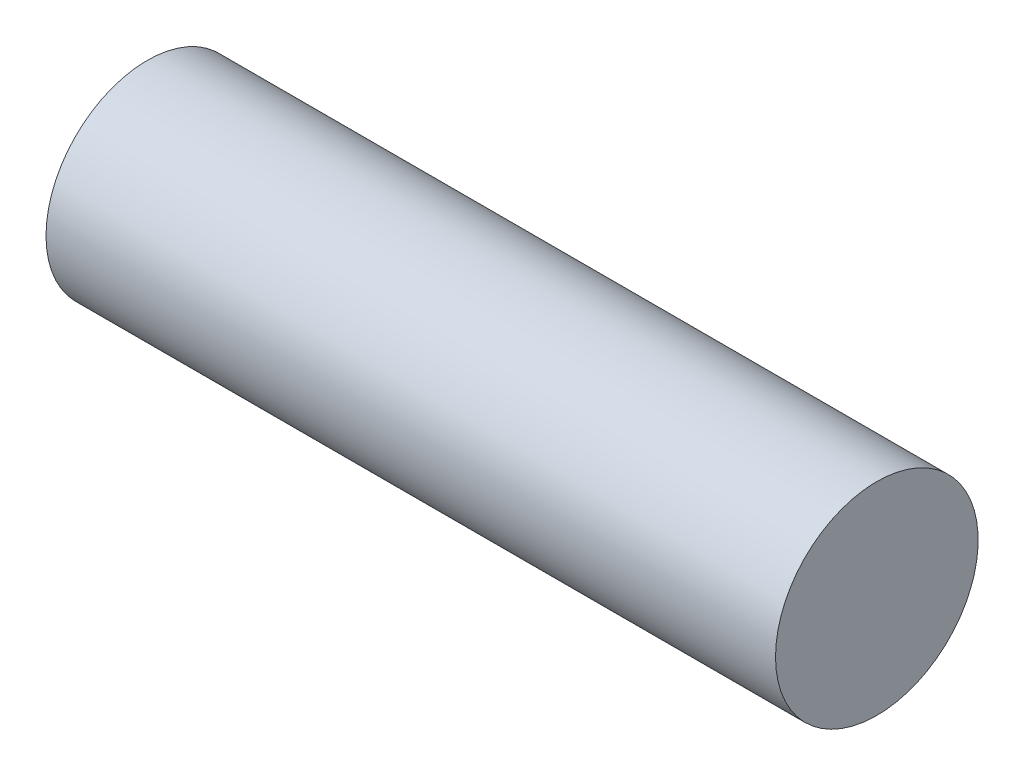
from build123d import *

# Parameters (mm, degrees)
SKETCH1_R           = 6.25
BOSS_EXTRUDE1_DEPTH = 45


with BuildPart() as part:
    # Sketch1 → Boss-Extrude1 (new body)
    with BuildSketch(Plane(origin=(0, 0, 0), x_dir=(0, 0, -1), z_dir=(1, 0, 0))):
        with Locations(Location((0, 0, 0), (0, 0, 180))):
            Circle(SKETCH1_R)
    extrude(amount=BOSS_EXTRUDE1_DEPTH)


solid = part.part
